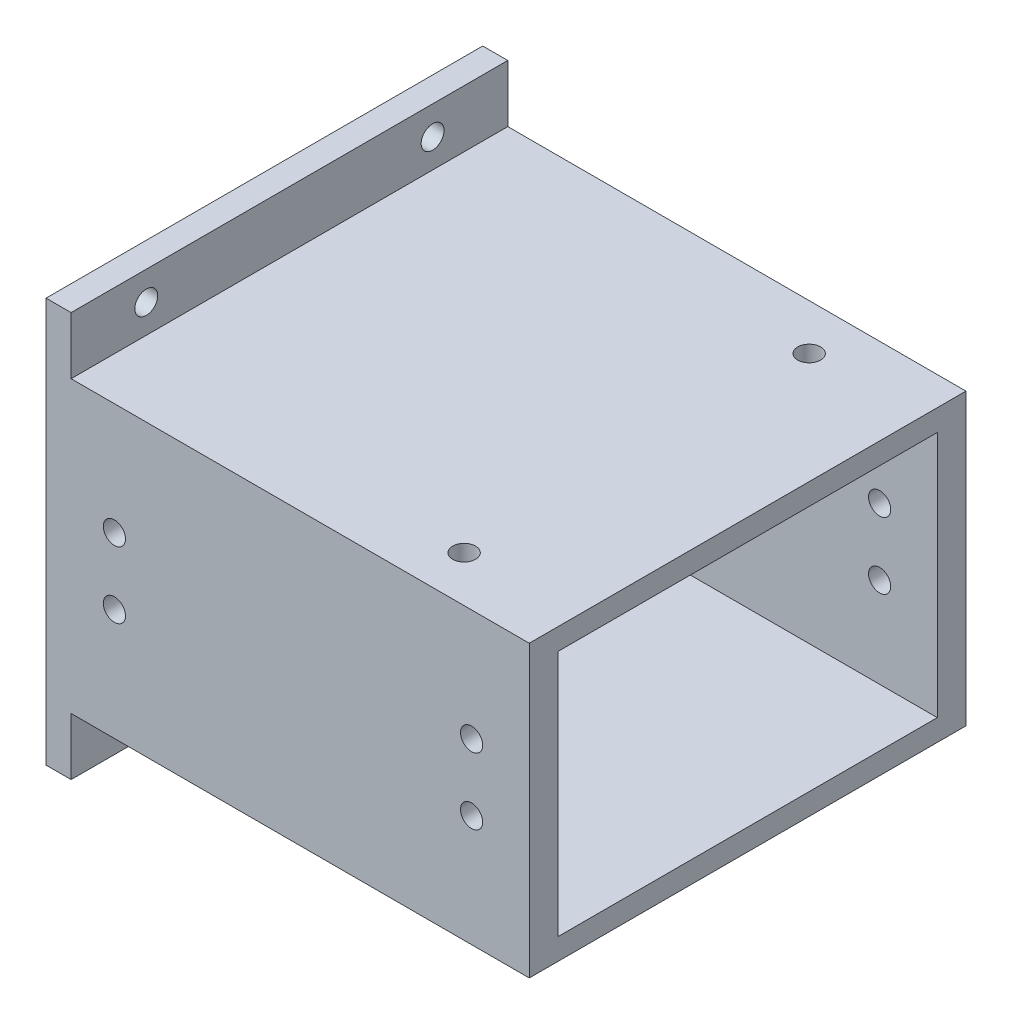
from build123d import *

# Parameters (mm, degrees)
SKETCH1_W                = 151
SKETCH1_H                = 61
SKETCH1_W_2              = 143
SKETCH1_H_2              = 53
BOSS_EXTRUDE1_DEPTH      = 20.25
SKETCH2_W                = 143
SKETCH2_H                = 53
BOSS_EXTRUDE2_DEPTH      = 3
SKETCH7_W                = 53
SKETCH7_H                = 37.5
CUT_EXTRUDE3_DEPTH       = 4
SKETCH9_W                = 147
SKETCH9_H                = 53
BOSS_EXTRUDE3_DEPTH      = 3
CUT_EXTRUDE4_REACH       = 92.944
SKETCH10_R               = 1.6
SKETCH12_R               = 1.55
CUT_EXTRUDE6_DEPTH       = 100.152975245
SKETCH13_W               = 7
SKETCH13_H               = 19.36
BOSS_EXTRUDE4_DEPTH      = 2
SKETCH16_R               = 1.6
CUT_EXTRUDE7_DEPTH       = 10
SKETCH17_W               = 7
SKETCH17_H               = 15
SKETCH17_R               = 2
BOSS_EXTRUDE5_DEPTH      = 3
SKETCH18_R               = 1.6
CUT_EXTRUDE8_DEPTH       = 10
SKETCH19_W               = 25
SKETCH19_H               = 12
CUT_EXTRUDE9_DEPTH       = 105.834164756
SKETCH20_W               = 7
SKETCH20_H               = 61
BOSS_EXTRUDE6_DEPTH      = 8
CUT_EXTRUDE10_REACH      = 96.336
SKETCH21_R               = 1.6
CUT_EXTRUDE11_DEPTH      = 91.550826059
CUT_EXTRUDE11_DEPTH_BACK = 91.550826059
SKETCH22_W               = 90.903507757
SKETCH22_H               = 73.955491088


with BuildPart() as part:
    # Sketch1 → Boss-Extrude1 (new, symmetric)
    with BuildSketch(Plane(origin=(0, 0, 0), x_dir=(1, 0, 0), z_dir=(0, 1, 0))):
        Rectangle(SKETCH1_W, SKETCH1_H)
        Rectangle(SKETCH1_W_2, SKETCH1_H_2, mode=Mode.SUBTRACT)
    extrude(amount=BOSS_EXTRUDE1_DEPTH, both=True)

    # Sketch2 → Boss-Extrude2 (add)
    with BuildSketch(Plane.XZ.offset(20.25)):
        Rectangle(SKETCH2_W, SKETCH2_H)
    extrude(amount=-BOSS_EXTRUDE2_DEPTH)

    # Sketch7 → Cut-Extrude3 (cut)
    with BuildSketch(Plane(origin=(75.5, 0, 0), x_dir=(0, 0, -1), z_dir=(1, 0, 0))):
        with Locations((0, 1.5)):
            Rectangle(SKETCH7_W, SKETCH7_H)
    extrude(amount=-CUT_EXTRUDE3_DEPTH, mode=Mode.SUBTRACT)

    # Sketch9 → Boss-Extrude3 (add)
    with BuildSketch(Plane(origin=(0, 20.25, 0), x_dir=(1, 0, 0), z_dir=(0, 1, 0))):
        with Locations((2, 0)):
            Rectangle(SKETCH9_W, SKETCH9_H)
    extrude(amount=-BOSS_EXTRUDE3_DEPTH)

    # Sketch10 → Cut-Extrude4 (cut, up to next)
    with BuildSketch(Plane(origin=(0, 20.25, 0), x_dir=(1, 0, 0), z_dir=(0, 1, 0)), mode=Mode.PRIVATE) as cut_extrude4_sk1:
        with Locations(Location((60, 24.1, 0), (0, 0, 270))):
            Circle(SKETCH10_R)
    cut_extrude4_tool1 = extrude(cut_extrude4_sk1.sketch, amount=-CUT_EXTRUDE4_REACH, mode=Mode.PRIVATE) & part.part
    # Sketch10 → Cut-Extrude4 (cut, up to next)
    with BuildSketch(Plane(origin=(0, 20.25, 0), x_dir=(1, 0, 0), z_dir=(0, 1, 0)), mode=Mode.PRIVATE) as cut_extrude4_sk2:
        with Locations(Location((60, -24.1, 0), (0, 0, 90))):
            Circle(SKETCH10_R)
    cut_extrude4_tool2 = extrude(cut_extrude4_sk2.sketch, amount=-CUT_EXTRUDE4_REACH, mode=Mode.PRIVATE) & part.part
    # Sketch10 → Cut-Extrude4 (cut, up to next)
    with BuildSketch(Plane(origin=(0, 20.25, 0), x_dir=(1, 0, 0), z_dir=(0, 1, 0)), mode=Mode.PRIVATE) as cut_extrude4_sk3:
        with Locations(Location((-6.04, 21, 0), (0, 0, 270))):
            Circle(SKETCH10_R)
    cut_extrude4_tool3 = extrude(cut_extrude4_sk3.sketch, amount=-CUT_EXTRUDE4_REACH, mode=Mode.PRIVATE) & part.part
    # Sketch10 → Cut-Extrude4 (cut, up to next)
    with BuildSketch(Plane(origin=(0, 20.25, 0), x_dir=(1, 0, 0), z_dir=(0, 1, 0)), mode=Mode.PRIVATE) as cut_extrude4_sk4:
        with Locations(Location((-6.04, -21, 0), (0, 0, 90))):
            Circle(SKETCH10_R)
    cut_extrude4_tool4 = extrude(cut_extrude4_sk4.sketch, amount=-CUT_EXTRUDE4_REACH, mode=Mode.PRIVATE) & part.part
    add(cut_extrude4_tool1.solids().sort_by_distance((60, 20.25, -24.1))[0], mode=Mode.SUBTRACT)
    add(cut_extrude4_tool2.solids().sort_by_distance((60, 20.25, 24.1))[0], mode=Mode.SUBTRACT)
    add(cut_extrude4_tool3.solids().sort_by_distance((-6.04, 20.25, -21))[0], mode=Mode.SUBTRACT)
    add(cut_extrude4_tool4.solids().sort_by_distance((-6.04, 20.25, 21))[0], mode=Mode.SUBTRACT)

    # Sketch12 → Cut-Extrude6 (cut, through all)
    with BuildSketch(Plane.XY.offset(30.5)):
        with Locations((67.445205237, 4.65)):
            Circle(SKETCH12_R)
        with Locations((67.445205237, -4.65)):
            Circle(SKETCH12_R)
        with Locations((17.545205237, 4.65)):
            Circle(SKETCH12_R)
        with Locations((17.545205237, -4.65)):
            Circle(SKETCH12_R)
    extrude(amount=-CUT_EXTRUDE6_DEPTH, mode=Mode.SUBTRACT)

    # Sketch13 → Boss-Extrude4 (add)
    with BuildSketch(Plane.XY.offset(17)):
        with Locations((-69.37, 29.93)):
            Rectangle(SKETCH13_W, SKETCH13_H)
    boss_extrude4 = extrude(amount=BOSS_EXTRUDE4_DEPTH)

    # Sketch16 → Cut-Extrude7 (cut)
    with BuildSketch(Plane.XY.offset(19)):
        with Locations((-69.262241782, 24.85)):
            Circle(SKETCH16_R)
        with Locations((-69.262241782, 34.85)):
            Circle(SKETCH16_R)
    cut_extrude7 = extrude(amount=-CUT_EXTRUDE7_DEPTH, mode=Mode.SUBTRACT)

    # Mirror1: Boss-Extrude4, Cut-Extrude7 across plane
    add(boss_extrude4.mirror(Plane(origin=(-44.87, 0, 0), x_dir=(0, 0, 1), z_dir=(1, 0, 0))))
    add(cut_extrude7.mirror(Plane(origin=(-44.87, 0, 0), x_dir=(0, 0, 1), z_dir=(1, 0, 0))), mode=Mode.SUBTRACT)

    # Sketch17 → Boss-Extrude5 (add)
    with BuildSketch(Plane(origin=(0, 0, -30.5), x_dir=(-1, 0, 0), z_dir=(0, 0, -1))):
        with Locations((55.31, 27.75)):
            Rectangle(SKETCH17_W, SKETCH17_H)
        with Locations((55.31, 30.15)):
            Circle(SKETCH17_R, mode=Mode.SUBTRACT)
    extrude(amount=-BOSS_EXTRUDE5_DEPTH)

    # Sketch18 → Cut-Extrude8 (cut)
    with BuildSketch(Plane.XZ.offset(20.25)):
        with Locations(Location((-56.5, 20, 0), (0, 0, 270))):
            Circle(SKETCH18_R)
        with Locations(Location((-56.5, -20, 0), (0, 0, 270))):
            Circle(SKETCH18_R)
    extrude(amount=-CUT_EXTRUDE8_DEPTH, mode=Mode.SUBTRACT)

    # Sketch19 → Cut-Extrude9 (cut, through all)
    with BuildSketch(Plane.XY.offset(30.5)):
        with Locations((-56, -11.25)):
            Rectangle(SKETCH19_W, SKETCH19_H)
    extrude(amount=-CUT_EXTRUDE9_DEPTH, mode=Mode.SUBTRACT)

    # Sketch20 → Boss-Extrude6 (add)
    with BuildSketch(Plane(origin=(0, 20.25, 0), x_dir=(1, 0, 0), z_dir=(0, 1, 0))):
        with Locations((8, 0)):
            Rectangle(SKETCH20_W, SKETCH20_H)
    boss_extrude6 = extrude(amount=BOSS_EXTRUDE6_DEPTH)

    # Sketch21 → Cut-Extrude10 (cut, up to next)
    with BuildSketch(Plane.ZY.offset(-4.5), mode=Mode.PRIVATE) as cut_extrude10_sk1:
        with Locations((-20, 24.25)):
            Circle(SKETCH21_R)
    cut_extrude10_tool1 = extrude(cut_extrude10_sk1.sketch, amount=-CUT_EXTRUDE10_REACH, mode=Mode.PRIVATE) & part.part
    # Sketch21 → Cut-Extrude10 (cut, up to next)
    with BuildSketch(Plane.ZY.offset(-4.5), mode=Mode.PRIVATE) as cut_extrude10_sk2:
        with Locations((20, 24.25)):
            Circle(SKETCH21_R)
    cut_extrude10_tool2 = extrude(cut_extrude10_sk2.sketch, amount=-CUT_EXTRUDE10_REACH, mode=Mode.PRIVATE) & part.part
    cut_extrude10_1 = cut_extrude10_tool1.solids().sort_by_distance((4.5, 24.25, -20))[0]
    add(cut_extrude10_1, mode=Mode.SUBTRACT)
    cut_extrude10_2 = cut_extrude10_tool2.solids().sort_by_distance((4.5, 24.25, 20))[0]
    add(cut_extrude10_2, mode=Mode.SUBTRACT)
    cut_extrude10 = cut_extrude10_1 + cut_extrude10_2  # Cut-Extrude10 as one shape, for the pattern or mirror that repeats it

    # Mirror2: Boss-Extrude6, Cut-Extrude10 across plane
    add(boss_extrude6.mirror(Plane.ZX))
    add(cut_extrude10.mirror(Plane.ZX), mode=Mode.SUBTRACT)

    # Sketch22 → Cut-Extrude11 (cut, two sides: drawn at the far end of the back side and taken through both)
    with BuildSketch(Plane(origin=(0, 0, 0), x_dir=(1, 0, 0), z_dir=(0, 1, 0)).offset(-CUT_EXTRUDE11_DEPTH_BACK)):
        with Locations((-37.451753878, 4.7681e-05)):
            Rectangle(SKETCH22_W, SKETCH22_H)
    extrude(amount=CUT_EXTRUDE11_DEPTH + CUT_EXTRUDE11_DEPTH_BACK, mode=Mode.SUBTRACT)


solid = part.part
